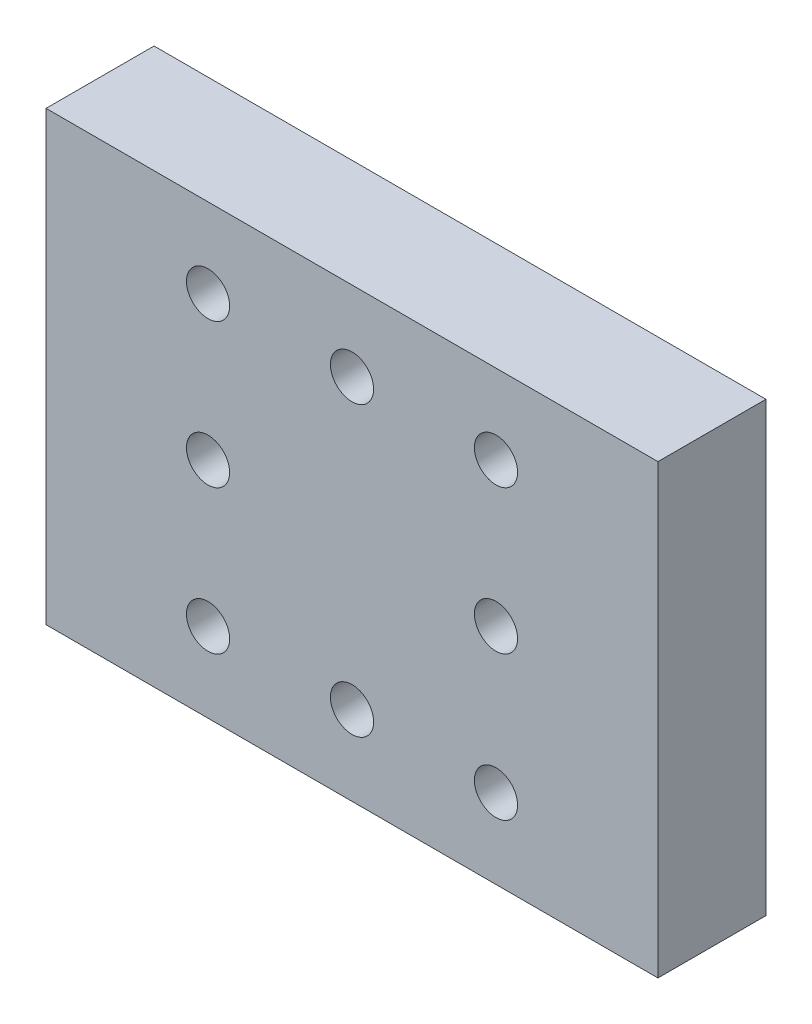
from build123d import *

# Parameters (mm, degrees)
ESQUISSE1_W             = 34
ESQUISSE1_H             = 24.85
BOSS_EXTRU_1_DEPTH      = 6
ESQUISSE2_R             = 1.2
ENL_V_MAT_EXTRU_1_DEPTH = 22.894762502


with BuildPart() as part:
    # Esquisse1 → Boss.-Extru.1 (new body)
    with BuildSketch(Plane.XY):
        Rectangle(ESQUISSE1_W, ESQUISSE1_H)
    extrude(amount=BOSS_EXTRU_1_DEPTH)

    # Esquisse2 → Enlèv. mat.-Extru.1 (cut, through all)
    with BuildSketch(Plane.XY.offset(6)):
        with Locations((-8, 8.005)):
            Circle(ESQUISSE2_R)
        with Locations(Location((8, 8.005, 0), (0, 0, 180))):
            Circle(ESQUISSE2_R)
        with Locations((0, 8.005)):
            Circle(ESQUISSE2_R)
        with Locations(Location((0, -8.005, 0), (0, 0, 180))):
            Circle(ESQUISSE2_R)
        with Locations((8, -8.005)):
            Circle(ESQUISSE2_R)
        with Locations(Location((-8, -8.005, 0), (0, 0, 180))):
            Circle(ESQUISSE2_R)
        with Locations((-8, 0)):
            Circle(ESQUISSE2_R)
        with Locations((8, 0)):
            Circle(ESQUISSE2_R)
    extrude(amount=-ENL_V_MAT_EXTRU_1_DEPTH, mode=Mode.SUBTRACT)


solid = part.part
